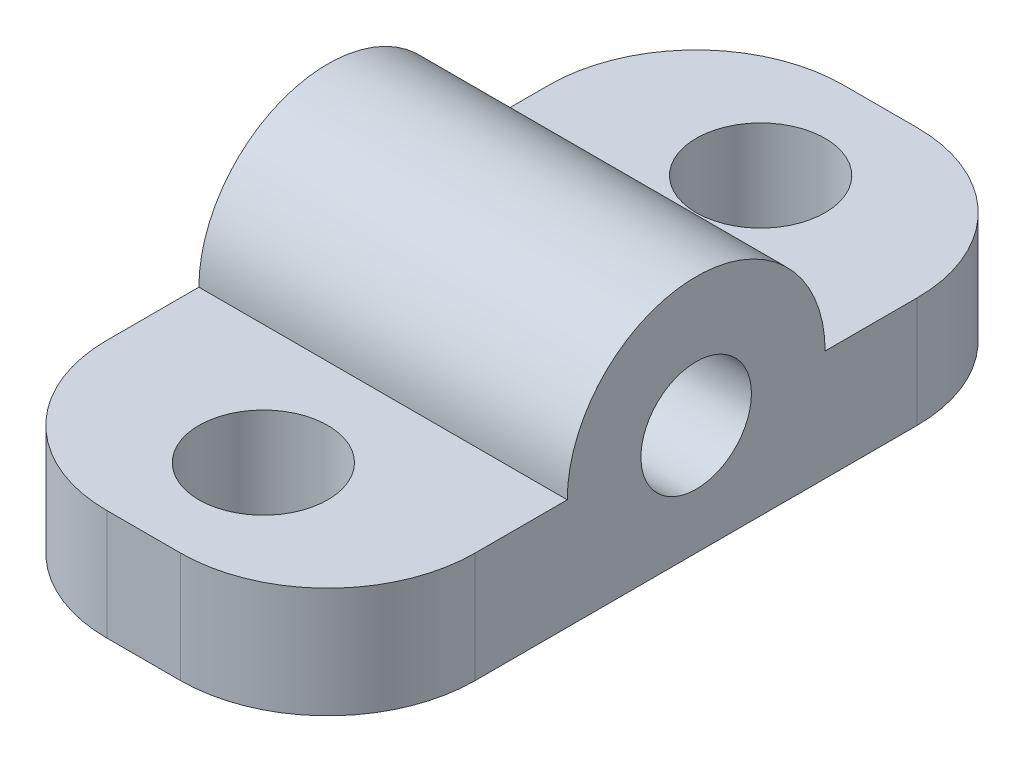
from build123d import *

# Parameters (mm, degrees)
SKETCH_1_R          = 1.5
EXTRUDE_1_DEPTH     = 10
SKETCH_2_R          = 1.75
CUT_EXTRUDE_1_DEPTH = 15.568802284
FILLET_2_R          = 4


with BuildPart() as part:
    # Эскиз1 → Бобышка-Вытянуть1 (new body)
    with BuildSketch(Plane(origin=(0, 0, 0), x_dir=(0, 0, -1), z_dir=(1, 0, 0))):
        with BuildLine():
            Line((-10, -3), (10, -3))
            Line((10, -3), (10, 0))
            Line((10, 0), (3.5, 0))
            ThreePointArc((3.5, 0), (0, 3.5), (-3.5, 0))
            Line((-3.5, 0), (-10, 0))
            Line((-10, 0), (-10, -3))
        make_face()
        Circle(SKETCH_1_R, mode=Mode.SUBTRACT)
    extrude(amount=EXTRUDE_1_DEPTH)

    # Эскиз2 → Вырез-Вытянуть1 (cut, through all)
    with BuildSketch(Plane(origin=(0, 0, 0), x_dir=(1, 0, 0), z_dir=(0, 1, 0))):
        with Locations(Location((5, 6.75, 0), (0, 0, 270))):
            Circle(SKETCH_2_R)
        with Locations(Location((5, -6.75, 0), (0, 0, 270))):
            Circle(SKETCH_2_R)
    extrude(amount=-CUT_EXTRUDE_1_DEPTH, mode=Mode.SUBTRACT)

    # Скругление2
    fillet_2_edges = [part.edges().sort_by_distance(p)[0] for p in [
        (10, -1.5, -10),
        (10, -1.5, 10),
        (0, -1.5, -10),
        (0, -1.5, 10),
    ]]
    fillet(fillet_2_edges, radius=FILLET_2_R)


solid = part.part
